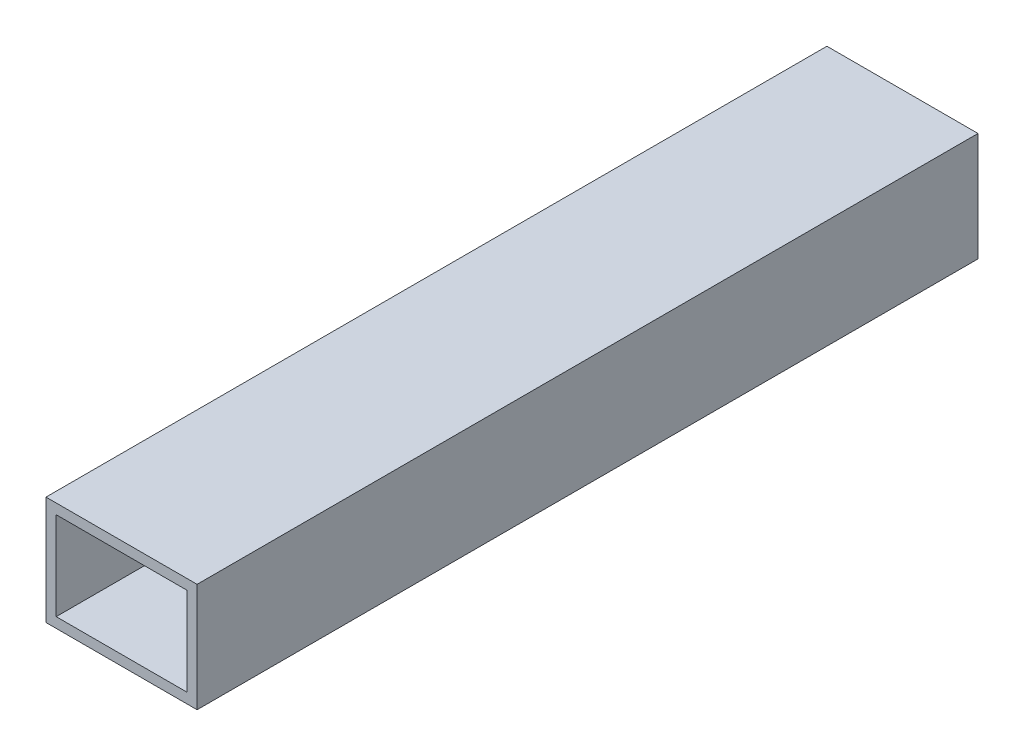
from build123d import *

# Parameters (mm, degrees)
AICAD_SKETCH_F001_W           = 17.8
AICAD_SKETCH_F001_H           = 12.8
AICAD_F001_BASE_EXTRUDE_DEPTH = 92
AICAD_SKETCH_F002_W           = 15.4
AICAD_SKETCH_F002_H           = 10.4
AICAD_F002_CUT_EXTRUDE_DEPTH  = 93.650796003


with BuildPart() as part:
    # AICAD_SKETCH_F001 → AICAD_F001_BASE_EXTRUDE (new body)
    with BuildSketch(Plane.XY):
        Rectangle(AICAD_SKETCH_F001_W, AICAD_SKETCH_F001_H)
    extrude(amount=AICAD_F001_BASE_EXTRUDE_DEPTH)

    # AICAD_SKETCH_F002 → AICAD_F002_CUT_EXTRUDE (cut, through all)
    with BuildSketch(Plane.XY.offset(92)):
        Rectangle(AICAD_SKETCH_F002_W, AICAD_SKETCH_F002_H)
    extrude(amount=-AICAD_F002_CUT_EXTRUDE_DEPTH, mode=Mode.SUBTRACT)


solid = part.part
